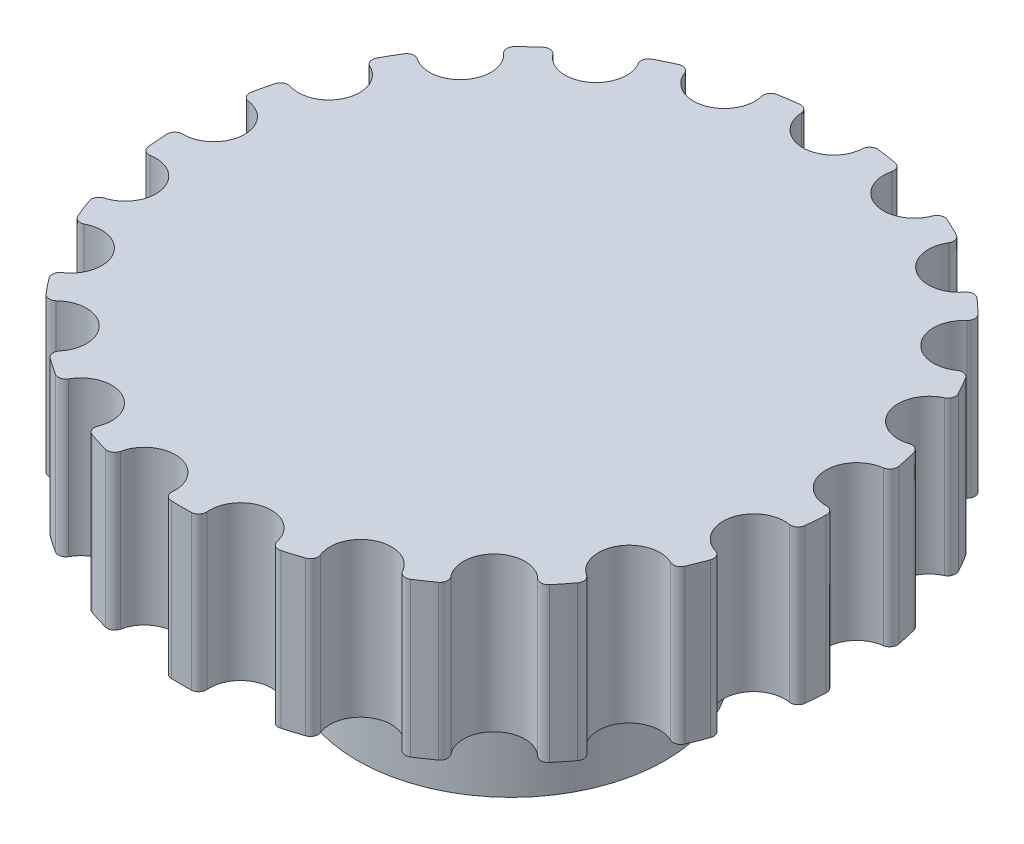
from build123d import *

# Parameters (mm, degrees)
BOSS_EXTRUDE1_DEPTH = 3
SKETCH2_R           = 3
BOSS_EXTRUDE2_DEPTH = 3


with BuildPart() as part:
    # Sketch1 → Boss-Extrude1 (new body)
    with BuildSketch(Plane(origin=(0, 0, 0), x_dir=(1, 0, 0), z_dir=(0, 1, 0))):
        with BuildLine():
            ThreePointArc((0.599315108, 6.251847506), (0.655076135, 6.353146394), (0.766324552, 6.384682827))
            ThreePointArc((0.766324552, 6.384682827), (0.958417427, 6.358684153), (1.149639398, 6.32690741))
            ThreePointArc((1.149639398, 6.32690741), (1.246649833, 6.263981006), (1.270075183, 6.150746692))
            ThreePointArc((1.270075183, 6.150746692), (1.674359011, 5.428138595), (2.415453621, 5.797444234))
            ThreePointArc((2.415453621, 5.797444234), (2.498595714, 5.877806845), (2.614197203, 5.875151156))
            ThreePointArc((2.614197203, 5.875151156), (2.790092686, 5.793687161), (2.963452842, 5.706958505))
            ThreePointArc((2.963452842, 5.706958505), (3.037605493, 5.618233416), (3.02661372, 5.503125042))
            ThreePointArc((3.02661372, 5.503125042), (3.199943877, 4.693455645), (4.01696848, 4.827912599))
            ThreePointArc((4.01696848, 4.827912599), (4.120104099, 4.880198364), (4.229786959, 4.843586522))
            ThreePointArc((4.229786959, 4.843586522), (4.373855966, 4.71389564), (4.513950497, 4.579921291))
            ThreePointArc((4.513950497, 4.579921291), (4.558656574, 4.473281132), (4.514224346, 4.366526582))
            ThreePointArc((4.514224346, 4.366526582), (4.441199686, 3.541738564), (5.261558062, 3.429399744))
            ThreePointArc((5.261558062, 3.429399744), (5.375523153, 3.448962841), (5.469541583, 3.38164797))
            ThreePointArc((5.469541583, 3.38164797), (5.568982949, 3.215253805), (5.66336384, 3.045937973))
            ThreePointArc((5.66336384, 3.045937973), (5.674651014, 2.930858189), (5.600726329, 2.841943073))
            ThreePointArc((5.600726329, 2.841943073), (5.287835413, 2.075322469), (6.038635119, 1.726169671))
            ThreePointArc((6.038635119, 1.726169671), (6.153303386, 1.711271834), (6.223303434, 1.619235156))
            ThreePointArc((6.223303434, 1.619235156), (6.269281358, 1.430922559), (6.309562454, 1.241309698))
            ThreePointArc((6.309562454, 1.241309698), (6.286427808, 1.128015634), (6.189579198, 1.06484045))
            ThreePointArc((6.189579198, 1.06484045), (5.664623759, 0.424504865), (6.279152947, -0.130438152))
            ThreePointArc((6.279152947, -0.130438152), (6.384335609, -0.178473184), (6.424097465, -0.287053808))
            ThreePointArc((6.424097465, -0.287053808), (6.412526606, -0.480552436), (6.395128754, -0.67361439))
            ThreePointArc((6.395128754, -0.67361439), (6.339627904, -0.775056061), (6.228460794, -0.806877919))
            ThreePointArc((6.228460794, -0.806877919), (5.538085424, -1.264031859), (5.961740479, -1.975455973))
            ThreePointArc((5.961740479, -1.975455973), (6.048091597, -2.052360078), (6.054082244, -2.167836781))
            ThreePointArc((6.054082244, -2.167836781), (5.985990725, -2.349328237), (5.912459799, -2.528684884))
            ThreePointArc((5.912459799, -2.528684884), (5.829524239, -2.609260623), (5.713916315, -2.606901645))
            ThreePointArc((5.713916315, -2.606901645), (4.919463897, -2.840253805), (5.114601207, -3.644945861))
            ThreePointArc((5.114601207, -3.644945861), (5.174448104, -3.743885771), (5.146135247, -3.855997943))
            ThreePointArc((5.146135247, -3.855997943), (5.027573298, -4.009355916), (4.904442846, -4.159070629))
            ThreePointArc((4.904442846, -4.159070629), (4.801441763, -4.211620928), (4.691665296, -4.175290719))
            ThreePointArc((4.691665296, -4.175290719), (3.863726413, -4.164106736), (3.813007173, -4.990566314))
            ThreePointArc((3.813007173, -4.990566314), (3.84103219, -5.102750785), (3.780931551, -5.201536766))
            ThreePointArc((3.780931551, -5.201536766), (3.62243392, -5.313134726), (3.460644622, -5.419904697))
            ThreePointArc((3.460644622, -5.419904697), (3.346730116, -5.439760232), (3.252539227, -5.37268689))
            ThreePointArc((3.252539227, -5.37268689), (2.464679882, -5.11796051), (2.172610718, -5.89275305))
            ThreePointArc((2.172610718, -5.89275305), (2.166323709, -6.008213997), (2.079775494, -6.084896221))
            ThreePointArc((2.079775494, -6.084896221), (1.895425392, -6.1448182), (1.709352937, -6.199156447))
            ThreePointArc((1.709352937, -6.199156447), (1.594646812, -6.184552967), (1.524410773, -6.092696253))
            ThreePointArc((1.524410773, -6.092696253), (0.846635727, -5.617061033), (0.339168267, -6.271342817))
            ThreePointArc((0.339168267, -6.271342817), (0.29912786, -6.37982103), (0.193822257, -6.427585943))
            ThreePointArc((0.193822257, -6.427585943), (0, -6.43050761), (-0.193822257, -6.427585943))
            ThreePointArc((-0.193822257, -6.427585943), (-0.29912786, -6.37982103), (-0.339168267, -6.271342817))
            ThreePointArc((-0.339168267, -6.271342817), (-0.846635727, -5.617061033), (-1.524410773, -6.092696253))
            ThreePointArc((-1.524410773, -6.092696253), (-1.594646812, -6.184552967), (-1.709352937, -6.199156447))
            ThreePointArc((-1.709352937, -6.199156447), (-1.895425392, -6.1448182), (-2.079775494, -6.084896221))
            ThreePointArc((-2.079775494, -6.084896221), (-2.166323709, -6.008213997), (-2.172610718, -5.89275305))
            ThreePointArc((-2.172610718, -5.89275305), (-2.464679882, -5.11796051), (-3.252539227, -5.37268689))
            ThreePointArc((-3.252539227, -5.37268689), (-3.346730116, -5.439760232), (-3.460644622, -5.419904697))
            ThreePointArc((-3.460644622, -5.419904697), (-3.62243392, -5.313134726), (-3.780931551, -5.201536766))
            ThreePointArc((-3.780931551, -5.201536766), (-3.84103219, -5.102750785), (-3.813007173, -4.990566314))
            ThreePointArc((-3.813007173, -4.990566314), (-3.863726413, -4.164106736), (-4.691665296, -4.175290719))
            ThreePointArc((-4.691665296, -4.175290719), (-4.801441763, -4.211620928), (-4.904442846, -4.159070629))
            ThreePointArc((-4.904442846, -4.159070629), (-5.027573298, -4.009355916), (-5.146135247, -3.855997943))
            ThreePointArc((-5.146135247, -3.855997943), (-5.174448104, -3.743885771), (-5.114601207, -3.644945861))
            ThreePointArc((-5.114601207, -3.644945861), (-4.919463897, -2.840253805), (-5.713916315, -2.606901645))
            ThreePointArc((-5.713916315, -2.606901645), (-5.829524239, -2.609260623), (-5.912459799, -2.528684884))
            ThreePointArc((-5.912459799, -2.528684884), (-5.985990725, -2.349328237), (-6.054082244, -2.167836781))
            ThreePointArc((-6.054082244, -2.167836781), (-6.048091597, -2.052360078), (-5.961740479, -1.975455973))
            ThreePointArc((-5.961740479, -1.975455973), (-5.538085424, -1.264031859), (-6.228460794, -0.806877919))
            ThreePointArc((-6.228460794, -0.806877919), (-6.339627904, -0.775056061), (-6.395128754, -0.67361439))
            ThreePointArc((-6.395128754, -0.67361439), (-6.412526606, -0.480552436), (-6.424097465, -0.287053808))
            ThreePointArc((-6.424097465, -0.287053808), (-6.384335609, -0.178473184), (-6.279152947, -0.130438152))
            ThreePointArc((-6.279152947, -0.130438152), (-5.664623759, 0.424504865), (-6.189579198, 1.06484045))
            ThreePointArc((-6.189579198, 1.06484045), (-6.286427808, 1.128015634), (-6.309562454, 1.241309698))
            ThreePointArc((-6.309562454, 1.241309698), (-6.269281358, 1.430922559), (-6.223303434, 1.619235156))
            ThreePointArc((-6.223303434, 1.619235156), (-6.153303386, 1.711271834), (-6.038635119, 1.726169671))
            ThreePointArc((-6.038635119, 1.726169671), (-5.287835413, 2.075322469), (-5.600726329, 2.841943073))
            ThreePointArc((-5.600726329, 2.841943073), (-5.674651014, 2.930858189), (-5.66336384, 3.045937973))
            ThreePointArc((-5.66336384, 3.045937973), (-5.568982949, 3.215253805), (-5.469541583, 3.38164797))
            ThreePointArc((-5.469541583, 3.38164797), (-5.375523153, 3.448962841), (-5.261558062, 3.429399744))
            ThreePointArc((-5.261558062, 3.429399744), (-4.441199686, 3.541738564), (-4.514224346, 4.366526582))
            ThreePointArc((-4.514224346, 4.366526582), (-4.558656574, 4.473281132), (-4.513950497, 4.579921291))
            ThreePointArc((-4.513950497, 4.579921291), (-4.373855966, 4.71389564), (-4.229786959, 4.843586522))
            ThreePointArc((-4.229786959, 4.843586522), (-4.120104099, 4.880198364), (-4.01696848, 4.827912599))
            ThreePointArc((-4.01696848, 4.827912599), (-3.199943877, 4.693455645), (-3.02661372, 5.503125042))
            ThreePointArc((-3.02661372, 5.503125042), (-3.037605493, 5.618233416), (-2.963452842, 5.706958505))
            ThreePointArc((-2.963452842, 5.706958505), (-2.790092686, 5.793687161), (-2.614197203, 5.875151156))
            ThreePointArc((-2.614197203, 5.875151156), (-2.498595714, 5.877806845), (-2.415453621, 5.797444234))
            ThreePointArc((-2.415453621, 5.797444234), (-1.674359011, 5.428138595), (-1.270075183, 6.150746692))
            ThreePointArc((-1.270075183, 6.150746692), (-1.246649833, 6.263981006), (-1.149639398, 6.32690741))
            ThreePointArc((-1.149639398, 6.32690741), (-0.958417427, 6.358684153), (-0.766324552, 6.384682827))
            ThreePointArc((-0.766324552, 6.384682827), (-0.655076135, 6.353146394), (-0.599315108, 6.251847506))
            ThreePointArc((-0.599315108, 6.251847506), (0, 5.68050761), (0.599315108, 6.251847506))
        make_face()
    extrude(amount=BOSS_EXTRUDE1_DEPTH)

    # Sketch2 → Boss-Extrude2 (add)
    with BuildSketch(Plane(origin=(0, 0, 0), x_dir=(-1, 0, 0), z_dir=(0, -1, 0))):
        with Locations(Location((0, 0, 0), (0, 0, 270))):
            Circle(SKETCH2_R)
    extrude(amount=BOSS_EXTRUDE2_DEPTH)


solid = part.part
